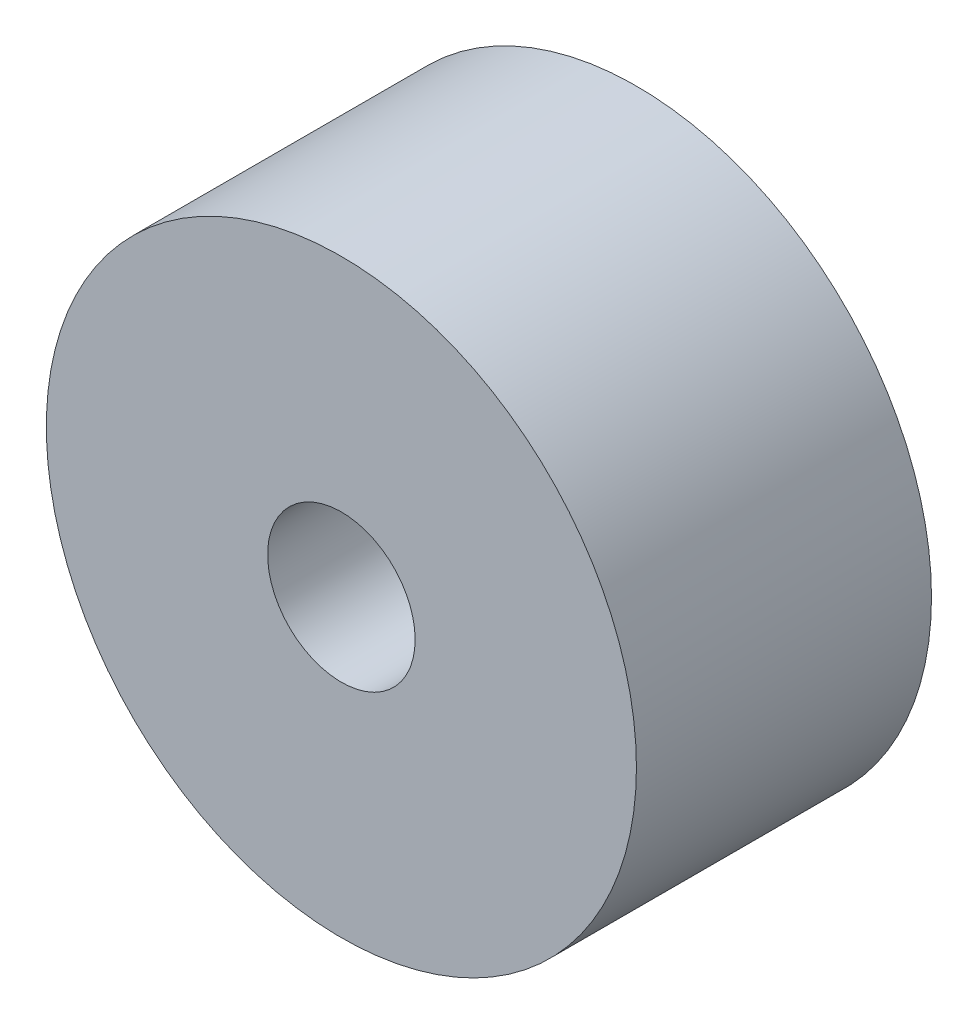
from build123d import *

# Parameters (mm, degrees)
SCHIZZO1_R                   = 10
SCHIZZO1_R_2                 = 2.5
ESTRUSIONE_ESTRUSIONE1_DEPTH = 10


with BuildPart() as part:
    # Schizzo1 → Estrusione-Estrusione1 (new body)
    with BuildSketch(Plane.XY):
        Circle(SCHIZZO1_R)
        Circle(SCHIZZO1_R_2, mode=Mode.SUBTRACT)
    extrude(amount=ESTRUSIONE_ESTRUSIONE1_DEPTH)


solid = part.part
